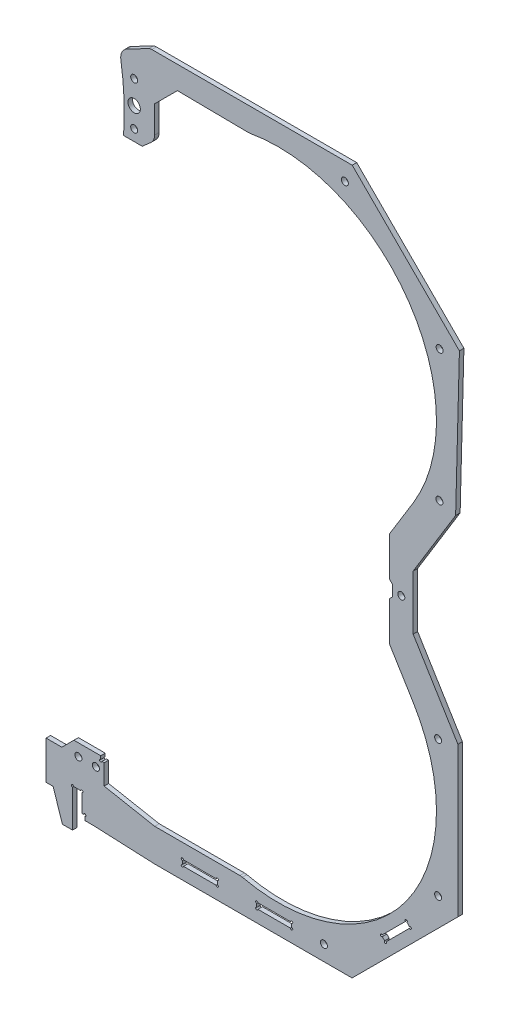
from build123d import *

# Parameters (mm, degrees)
SKETCH_6441_R           = 1.55
SKETCH_6441_R_2         = 2.75
EXTRUDE_13625_DEPTH     = 2
FILLET_13791_R          = 5
SKETCH_13989_W          = 15.5
SKETCH_13989_H          = 2.5
CUT_EXTRUDE_14254_DEPTH = 246.566929957
SKETCH_14301_R          = 1.55
CUT_EXTRUDE_14313_DEPTH = 246.566929957
SKETCH_14441_R          = 0.5
CUT_EXTRUDE_14789_DEPTH = 246.566929957


with BuildPart() as part:
    # Sketch 6441 → Extrude 13625 (new body)
    with BuildSketch(Plane.XY):
        with BuildLine():
            Line((183.657608305, 107.001013939), (136.084964988, 154.573657256))
            Line((136.084964988, 154.573657256), (47.204437863, 154.573657256))
            ThreePointArc((47.204437863, 154.573657256), (46.497305667, 154.48912704), (45.830022829, 154.240299961))
            Line((45.830022829, 154.240299961), (36.239566526, 149.297280299))
            ThreePointArc((36.239566526, 149.297280299), (33.93663348, 146.980087891), (33.42537009, 143.753403677))
            ThreePointArc((33.42537009, 143.753403677), (34.835, 129.535814466), (34.629076425, 115.25))
            Line((34.629076425, 115.25), (42.916521639, 115.25))
            Line((42.916521639, 115.25), (48.416521639, 120.077827626))
            Line((48.416521639, 120.077827626), (48.416521639, 134.322222666))
            Line((48.416521639, 134.322222666), (58.529829123, 144.43553015))
            Line((58.529829123, 144.43553015), (90.426598369, 144.073657256))
            ThreePointArc((90.426598369, 144.073657256), (161.123508786, 114.790038144), (163.126615581, 38.294475829))
            Line((163.126615581, 38.294475829), (152.626615581, 21.160033114))
            Line((152.626615581, 21.160033114), (152.626615581, 3.75))
            Line((152.626615581, 3.75), (153.876615581, 2.5))
            Line((153.876615581, 2.5), (153.876615581, -2.5))
            Line((153.876615581, -2.5), (152.626615581, -3.75))
            Line((152.626615581, -3.75), (152.626615581, -21.160033114))
            Line((152.626615581, -21.160033114), (163.126615581, -38.294475829))
            ThreePointArc((163.126615581, -38.294475829), (160.06208789, -116.291913973), (86.829107225, -143.308986908))
            Line((86.829107225, -143.308986908), (48.416521639, -143.308986908))
            Line((48.416521639, -143.308986908), (26.001126091, -139.07316335))
            Line((26.001126091, -139.07316335), (26.001126091, -130.1))
            Line((26.001126091, -130.1), (24.501126091, -130.1))
            Line((24.501126091, -130.1), (24.501126091, -128.153933031))
            Line((24.501126091, -128.153933031), (12.591750717, -128.153933031))
            Line((12.591750717, -128.153933031), (7.25, -133.5))
            Line((7.25, -133.5), (0.25, -133.5))
            Line((0.25, -133.5), (0.25, -150.5))
            Line((0.25, -150.5), (3.358391833, -150.5))
            Line((3.358391833, -150.5), (7.5, -163))
            Line((7.5, -163), (12, -163))
            Line((12, -163), (12, -146))
            Line((12, -146), (16.1, -146))
            Line((16.1, -146), (16.1, -154.5))
            Line((16.1, -154.5), (17.45, -154.5))
            Line((17.45, -154.5), (17.45, -156.6))
            Line((17.45, -156.6), (21.353443149, -156.6))
            Line((21.353443149, -156.6), (48.416521639, -157.808986908))
            Line((48.416521639, -157.808986908), (136.031615851, -157.808986908))
            Line((136.031615851, -157.808986908), (182.978644035, -110.861958724))
            Line((182.978644035, -110.861958724), (182.978644035, -44.515806956))
            Line((182.978644035, -44.515806956), (163.126615581, -12.12024083))
            Line((163.126615581, -12.12024083), (163.126615581, 12.12024083))
            Line((163.126615581, 12.12024083), (181.978644035, 42.883955268))
            Line((181.978644035, 42.883955268), (183.657608305, 107.001013939))
        make_face()
        with Locations((14.6, -133.5)):
            Circle(SKETCH_6441_R, mode=Mode.SUBTRACT)
        with Locations((22.35, -133.5)):
            Circle(SKETCH_6441_R, mode=Mode.SUBTRACT)
        with Locations((39.335, 120.1823004)):
            Circle(SKETCH_6441_R, mode=Mode.SUBTRACT)
        with Locations((39.335, 129.0823004)):
            Circle(SKETCH_6441_R_2, mode=Mode.SUBTRACT)
        with Locations((39.335, 139.4323004)):
            Circle(SKETCH_6441_R, mode=Mode.SUBTRACT)
    extrude(amount=EXTRUDE_13625_DEPTH)

    # Fillet 13791
    fillet_13791_edges = [part.edges().sort_by_distance(p)[0] for p in [
        (86.829107225, -143.308986908, 1),
        (48.416521639, 120.077827626, 1),
        (90.426598369, 144.073657256, 1),
    ]]
    fillet(fillet_13791_edges, radius=FILLET_13791_R)

    # Sketch 13989 → Cut-Extrude 14254 (cut, through all)
    with BuildSketch(Plane.XY):
        Polygon((149.075304921, -134.865802902), (160.035460029, -123.905647794), (161.803226982, -125.673414746), (150.843071874, -136.633569855), align=None)
        with Locations((68.468496842, -151.058986908)):
            Rectangle(SKETCH_13989_W, SKETCH_13989_H)
        with Locations((101.468496842, -151.058986908)):
            Rectangle(SKETCH_13989_W, SKETCH_13989_H)
    extrude(amount=CUT_EXTRUDE_14254_DEPTH, mode=Mode.SUBTRACT)

    # Sketch 14301 → Cut-Extrude 14313 (cut, through all)
    with BuildSketch(Plane.XY):
        with Locations((157.876615581, 0)):
            Circle(SKETCH_14301_R)
        with Locations((174.201788477, -107.226466117)):
            Circle(SKETCH_14301_R)
        with Locations((123.531615851, -151.058986908)):
            Circle(SKETCH_14301_R)
        with Locations((174.880752746, 103.365521332)):
            Circle(SKETCH_14301_R)
        with Locations((132.832155813, 146.72068123)):
            Circle(SKETCH_14301_R)
        with Locations((174.201788477, -46.867558315)):
            Circle(SKETCH_14301_R)
        with Locations((174.787496024, 45.014070354)):
            Circle(SKETCH_14301_R)
    extrude(amount=CUT_EXTRUDE_14313_DEPTH, mode=Mode.SUBTRACT)

    # Sketch 14441 → Cut-Extrude 14789 (cut, through all)
    with BuildSketch(Plane.XY):
        with Locations((60.718496842, -149.808986908)):
            Circle(SKETCH_14441_R)
        with Locations((60.718496842, -152.308986908)):
            Circle(SKETCH_14441_R)
        with Locations((76.218496842, -152.308986908)):
            Circle(SKETCH_14441_R)
        with Locations((76.218496842, -149.808986908)):
            Circle(SKETCH_14441_R)
        with Locations((93.718496842, -149.808986908)):
            Circle(SKETCH_14441_R)
        with Locations((93.718496842, -152.308986908)):
            Circle(SKETCH_14441_R)
        with Locations((109.218496842, -152.308986908)):
            Circle(SKETCH_14441_R)
        with Locations((109.218496842, -149.808986908)):
            Circle(SKETCH_14441_R)
        with Locations((149.075304921, -134.865802902)):
            Circle(SKETCH_14441_R)
        with Locations((150.843071874, -136.633569855)):
            Circle(SKETCH_14441_R)
        with Locations((160.035460029, -123.905647794)):
            Circle(SKETCH_14441_R)
        with Locations((161.803226982, -125.673414746)):
            Circle(SKETCH_14441_R)
        with Locations((12, -146)):
            Circle(SKETCH_14441_R)
        with Locations((16.1, -146)):
            Circle(SKETCH_14441_R)
        with Locations((17.45, -154.5)):
            Circle(SKETCH_14441_R)
        with Locations((24.501126091, -130.1)):
            Circle(SKETCH_14441_R)
    extrude(amount=CUT_EXTRUDE_14789_DEPTH, mode=Mode.SUBTRACT)


solid = part.part
